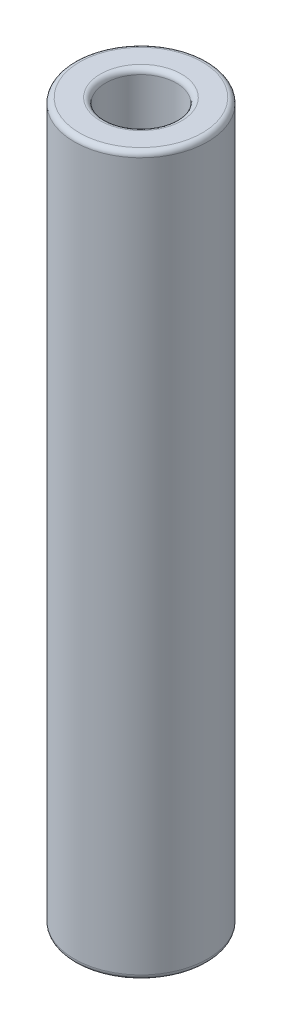
from build123d import *

# Parameters (mm, degrees)
SKETCH1_R           = 3.2
SKETCH1_R_2         = 1.7
BOSS_EXTRUDE1_DEPTH = 34.5
FILLET1_R           = 0.25


with BuildPart() as part:
    # Sketch1 → Boss-Extrude1 (new body)
    with BuildSketch(Plane(origin=(0, 0, 0), x_dir=(1, 0, 0), z_dir=(0, 1, 0))):
        with Locations(Location((0, 0, 0), (0, 0, 270))):
            Circle(SKETCH1_R)
        with Locations(Location((0, 0, 0), (0, 0, 270))):
            Circle(SKETCH1_R_2, mode=Mode.SUBTRACT)
    extrude(amount=BOSS_EXTRUDE1_DEPTH)

    # Fillet1
    fillet1_edges = [part.edges().sort_by_distance(p)[0] for p in [
        (0, 0, -3.2),
        (0, 34.5, -3.2),
        (0, 0, -1.7),
        (0, 34.5, -1.7),
    ]]
    fillet(fillet1_edges, radius=FILLET1_R)


solid = part.part
